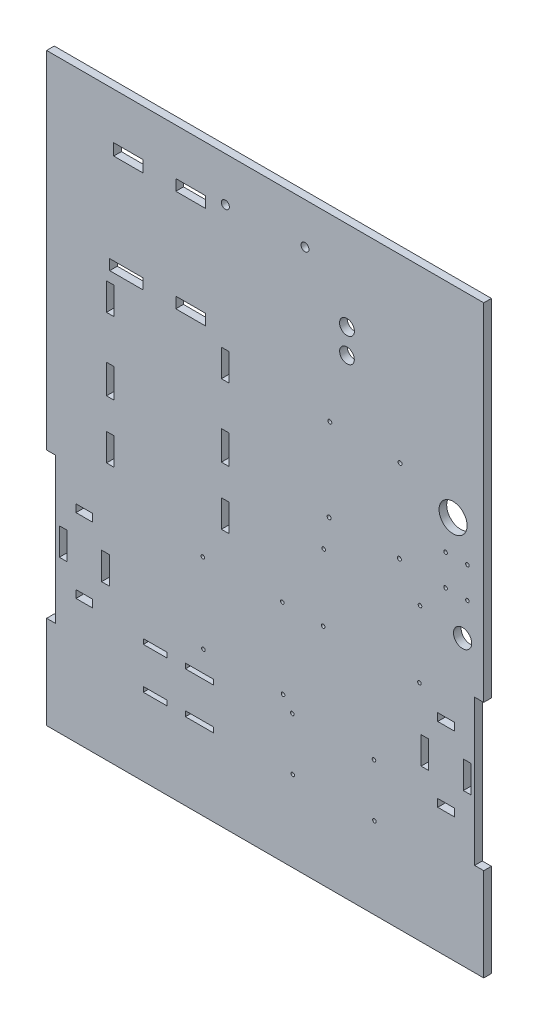
from build123d import *

# Parameters (mm, degrees)
SKETCH1_W                = 304.8
SKETCH1_H                = 304.8
BOSS_EXTRUDE1_DEPTH      = 5.334
SKETCH2_W                = 6.35
SKETCH2_H                = 101.6
CUT_EXTRUDE1_DEPTH       = 216.592141684
SKETCH26_W               = 11.599333334
SKETCH26_H               = 5.334
SKETCH26_W_2             = 5.334
SKETCH26_H_2             = 19.05
CUT_EXTRUDE11_DEPTH      = 216.592141684
SKETCH27_W               = 11.599333334
SKETCH27_H               = 5.334
SKETCH27_W_2             = 5.334
SKETCH27_H_2             = 19.05
CUT_EXTRUDE12_DEPTH      = 216.592141684
SKETCH29_W               = 304.8
SKETCH29_H               = 24.084758951
CUT_EXTRUDE13_DEPTH      = 216.592141684
SKETCH31_R               = 1.374999997
CUT_EXTRUDE15_DEPTH      = 216.592141684
SKETCH32_R               = 1.25
CUT_EXTRUDE16_DEPTH      = 216.592141684
SKETCH34_R               = 1.249249953
SKETCH34_R_2             = 1.249999995
SKETCH34_R_3             = 1.252496274
SKETCH34_R_4             = 1.251959019
CUT_EXTRUDE18_DEPTH      = 216.592141684
SKETCH38_R               = 1.248199844
SKETCH38_R_2             = 1.253619174
SKETCH38_R_3             = 1.25252158
SKETCH38_R_4             = 1.237868742
CUT_EXTRUDE22_DEPTH      = 216.592141684
SKETCH40_W               = 304.8
SKETCH40_H               = 5.334
BOSS_EXTRUDE2_DEPTH      = 76.2
SKETCH41_R               = 2.778125
CUT_EXTRUDE24_DEPTH      = 275.794780802
CUT_EXTRUDE25_DEPTH      = 275.794780802
CUT_EXTRUDE25_DEPTH_BACK = 275.794780802
SKETCH42_R               = 1.246523933
SKETCH42_R_2             = 1.251934436
SKETCH42_R_3             = 1.248703554
SKETCH42_R_4             = 1.245581387
SKETCH44_W               = 16.476980096
SKETCH44_H               = 3.5
SKETCH44_W_2             = 19.633145944
SKETCH44_H_2             = 3.596708667
CUT_EXTRUDE27_DEPTH      = 275.794780802
SKETCH45_W               = 20.354162164
SKETCH45_H               = 8.066046325
SKETCH45_W_2             = 20.554982424
SKETCH45_H_2             = 7.688212903
SKETCH45_H_3             = 7.652166289
SKETCH45_W_3             = 23.136298987
SKETCH45_H_4             = 7.272580335
CUT_EXTRUDE28_DEPTH      = 275.794780802
SKETCH46_W               = 304.8
SKETCH46_H               = 5.334
BOSS_EXTRUDE3_DEPTH      = 50.8
SKETCH47_R               = 9.778477959
SKETCH47_R_2             = 6.35205685
CUT_EXTRUDE29_DEPTH      = 275.794780802
SKETCH49_W               = 5.334
SKETCH49_H               = 19.05
SKETCH49_H_2             = 20.295839927
CUT_EXTRUDE30_DEPTH      = 275.794780802
SKETCH52_R               = 5.113702669
SKETCH52_R_2             = 5.177907844
CUT_EXTRUDE33_DEPTH      = 275.794780802


with BuildPart() as part:
    # Sketch1 → Boss-Extrude1 (new body)
    with BuildSketch(Plane.XY):
        Rectangle(SKETCH1_W, SKETCH1_H)
    extrude(amount=BOSS_EXTRUDE1_DEPTH)

    # Sketch2 → Cut-Extrude1 (cut, through all)
    with BuildSketch(Plane(origin=(0, 0, 0), x_dir=(-1, 0, 0), z_dir=(0, 0, -1))):
        with Locations((149.225, -63.5)):
            Rectangle(SKETCH2_W, SKETCH2_H)
        with Locations((-149.225, -63.5)):
            Rectangle(SKETCH2_W, SKETCH2_H)
    extrude(amount=-CUT_EXTRUDE1_DEPTH, mode=Mode.SUBTRACT)

    # Sketch26 → Cut-Extrude11 (cut, through all)
    with BuildSketch(Plane.XY.offset(5.334)):
        with Locations((-126.111, -89.408)):
            Rectangle(SKETCH26_W, SKETCH26_H)
        with Locations((-111.379, -63.5)):
            Rectangle(SKETCH26_W_2, SKETCH26_H_2)
        with Locations((-126.111, -37.592)):
            Rectangle(SKETCH26_W, SKETCH26_H)
        with Locations((-140.843, -63.5)):
            Rectangle(SKETCH26_W_2, SKETCH26_H_2)
    extrude(amount=-CUT_EXTRUDE11_DEPTH, mode=Mode.SUBTRACT)

    # Sketch27 → Cut-Extrude12 (cut, through all)
    with BuildSketch(Plane.XY.offset(5.334)):
        with Locations((126.111, -89.408)):
            Rectangle(SKETCH27_W, SKETCH27_H)
        with Locations((111.379, -63.5)):
            Rectangle(SKETCH27_W_2, SKETCH27_H_2)
        with Locations((126.111, -37.592)):
            Rectangle(SKETCH27_W, SKETCH27_H)
        with Locations((140.843, -63.5)):
            Rectangle(SKETCH27_W_2, SKETCH27_H_2)
    extrude(amount=-CUT_EXTRUDE12_DEPTH, mode=Mode.SUBTRACT)

    # Sketch29 → Cut-Extrude13 (cut, through all)
    with BuildSketch(Plane(origin=(0, 0, 0), x_dir=(-1, 0, 0), z_dir=(0, 0, -1))):
        with Locations((0, -140.357620525)):
            Rectangle(SKETCH29_W, SKETCH29_H)
    extrude(amount=-CUT_EXTRUDE13_DEPTH, mode=Mode.SUBTRACT)

    # Sketch31 → Cut-Extrude15 (cut, through all)
    with BuildSketch(Plane(origin=(0, 0, 0), x_dir=(-1, 0, 0), z_dir=(0, 0, -1))):
        with Locations((-94.072328828, 102.688814533)):
            Circle(SKETCH31_R)
        with Locations((-45.074194598, 103.116414773)):
            Circle(SKETCH31_R)
        with Locations((-93.566189769, 44.691022995)):
            Circle(SKETCH31_R)
        with Locations((-44.568055539, 45.118623235)):
            Circle(SKETCH31_R)
    extrude(amount=-CUT_EXTRUDE15_DEPTH, mode=Mode.SUBTRACT)

    # Sketch32 → Cut-Extrude16 (cut, through all)
    with BuildSketch(Plane(origin=(0, 0, 0), x_dir=(-1, 0, 0), z_dir=(0, 0, -1))):
        with Locations((-125.781887437, 64.718548335)):
            Circle(SKETCH32_R)
        with Locations((-141.021887437, 64.718548335)):
            Circle(SKETCH32_R)
        with Locations((-141.021887437, 43.128548335)):
            Circle(SKETCH32_R)
        with Locations((-125.781887437, 43.128548335)):
            Circle(SKETCH32_R)
    extrude(amount=-CUT_EXTRUDE16_DEPTH, mode=Mode.SUBTRACT)

    # Sketch34 → Cut-Extrude18 (cut, through all)
    with BuildSketch(Plane(origin=(0, 0, 0), x_dir=(-1, 0, 0), z_dir=(0, 0, -1))):
        with Locations((-75.859031626, -85.661481109)):
            Circle(SKETCH34_R)
        with Locations((-76.178771886, -122.30008597)):
            Circle(SKETCH34_R_2)
        with Locations((-19.220652784, -122.797151945)):
            Circle(SKETCH34_R_3)
        with Locations((-18.900912524, -86.158547084)):
            Circle(SKETCH34_R_4)
    extrude(amount=-CUT_EXTRUDE18_DEPTH, mode=Mode.SUBTRACT)

    # Sketch38 → Cut-Extrude22 (cut, through all)
    with BuildSketch(Plane(origin=(0, 0, 0), x_dir=(-1, 0, 0), z_dir=(0, 0, -1))):
        with Locations((43.524965306, -22.819488401)):
            Circle(SKETCH38_R)
        with Locations((-11.972921424, -22.335165681)):
            Circle(SKETCH38_R_2)
        with Locations((-12.457244144, -77.833052411)):
            Circle(SKETCH38_R_3)
        with Locations((43.040642586, -78.317375131)):
            Circle(SKETCH38_R_4)
    extrude(amount=-CUT_EXTRUDE22_DEPTH, mode=Mode.SUBTRACT)

    # Sketch40 → Boss-Extrude2 (add)
    with BuildSketch(Plane(origin=(0, 152.4, 0), x_dir=(1, 0, 0), z_dir=(0, 1, 0))):
        with Locations((0, -2.667)):
            Rectangle(SKETCH40_W, SKETCH40_H)
    extrude(amount=BOSS_EXTRUDE2_DEPTH)

    # Sketch41 → Cut-Extrude24 (cut, through all)
    with BuildSketch(Plane(origin=(0, 0, 0), x_dir=(-1, 0, 0), z_dir=(0, 0, -1))):
        with Locations((-27.760706508, 199.901266022)):
            Circle(SKETCH41_R)
        with Locations((27.760706508, 197.764889884)):
            Circle(SKETCH41_R)
    extrude(amount=-CUT_EXTRUDE24_DEPTH, mode=Mode.SUBTRACT)

    # Sketch42 → Cut-Extrude25 (cut, two sides: drawn at the far end of the back side and taken through both)
    with BuildSketch(Plane(origin=(0, 0, 0), x_dir=(-1, 0, 0), z_dir=(0, 0, -1)).offset(-CUT_EXTRUDE25_DEPTH_BACK)):
        with Locations((-40.428890621, -22.652536653)):
            Circle(SKETCH42_R)
        with Locations((-107.546334897, -23.238261716)):
            Circle(SKETCH42_R_2)
        with Locations((-107.954736758, 23.559956283)):
            Circle(SKETCH42_R_3)
        with Locations((-40.837292482, 24.145681346)):
            Circle(SKETCH42_R_4)
    extrude(amount=CUT_EXTRUDE25_DEPTH + CUT_EXTRUDE25_DEPTH_BACK, mode=Mode.SUBTRACT)

    # Sketch44 → Cut-Extrude27 (cut, through all)
    with BuildSketch(Plane(origin=(0, 0, 0), x_dir=(-1, 0, 0), z_dir=(0, 0, -1))):
        with Locations((76.712846496, -123.491430997)):
            Rectangle(SKETCH44_W, SKETCH44_H)
        with Locations((76.712846496, -94.591430997)):
            Rectangle(SKETCH44_W, SKETCH44_H)
        with Locations((45.782293013, -123.539785331)):
            Rectangle(SKETCH44_W_2, SKETCH44_H_2)
        with Locations((45.782293013, -94.688139664)):
            Rectangle(SKETCH44_W_2, SKETCH44_H)
    extrude(amount=-CUT_EXTRUDE27_DEPTH, mode=Mode.SUBTRACT)

    # Sketch45 → Cut-Extrude28 (cut, through all)
    with BuildSketch(Plane(origin=(0, 0, 0), x_dir=(-1, 0, 0), z_dir=(0, 0, -1))):
        with Locations((95.443302682, 192.238942395)):
            Rectangle(SKETCH45_W, SKETCH45_H)
        with Locations((52.047470718, 192.427859106)):
            Rectangle(SKETCH45_W_2, SKETCH45_H_2)
        with Locations((52.047470716, 121.434632147)):
            Rectangle(SKETCH45_W_2, SKETCH45_H_3)
        with Locations((96.834371094, 121.24483917)):
            Rectangle(SKETCH45_W_3, SKETCH45_H_4)
    extrude(amount=-CUT_EXTRUDE28_DEPTH, mode=Mode.SUBTRACT)

    # Sketch46 → Boss-Extrude3 (add)
    with BuildSketch(Plane.XZ.offset(128.315241049)):
        with Locations((0, 2.667)):
            Rectangle(SKETCH46_W, SKETCH46_H)
    extrude(amount=BOSS_EXTRUDE3_DEPTH)

    # Sketch47 → Cut-Extrude29 (cut, through all)
    with BuildSketch(Plane(origin=(0, 0, 0), x_dir=(-1, 0, 0), z_dir=(0, 0, -1))):
        with Locations((-131.017495066, 88.21224972)):
            Circle(SKETCH47_R)
        with Locations((-137.650958824, 18.755982137)):
            Circle(SKETCH47_R_2)
    extrude(amount=-CUT_EXTRUDE29_DEPTH, mode=Mode.SUBTRACT)

    # Sketch49 → Cut-Extrude30 (cut, through all)
    with BuildSketch(Plane.XY.offset(5.334)):
        with Locations((-27.846255785, 9.907194542)):
            Rectangle(SKETCH49_W, SKETCH49_H)
        with Locations((-107.982405159, 9.907194542)):
            Rectangle(SKETCH49_W, SKETCH49_H)
        with Locations((-107.982405159, 51.068016377)):
            Rectangle(SKETCH49_W, SKETCH49_H_2)
        with Locations((-107.982405159, 100.839194542)):
            Rectangle(SKETCH49_W, SKETCH49_H)
        with Locations((-27.846255785, 100.839194542)):
            Rectangle(SKETCH49_W, SKETCH49_H)
        with Locations((-27.846255785, 51.068016377)):
            Rectangle(SKETCH49_W, SKETCH49_H_2)
    extrude(amount=-CUT_EXTRUDE30_DEPTH, mode=Mode.SUBTRACT)

    # Sketch52 → Cut-Extrude33 (cut, through all)
    with BuildSketch(Plane(origin=(0, 0, 0), x_dir=(-1, 0, 0), z_dir=(0, 0, -1))):
        with Locations((-57.021451744, 149.159143491)):
            Circle(SKETCH52_R)
        with Locations((-57.021451744, 166.299522531)):
            Circle(SKETCH52_R_2)
    extrude(amount=-CUT_EXTRUDE33_DEPTH, mode=Mode.SUBTRACT)


solid = part.part
